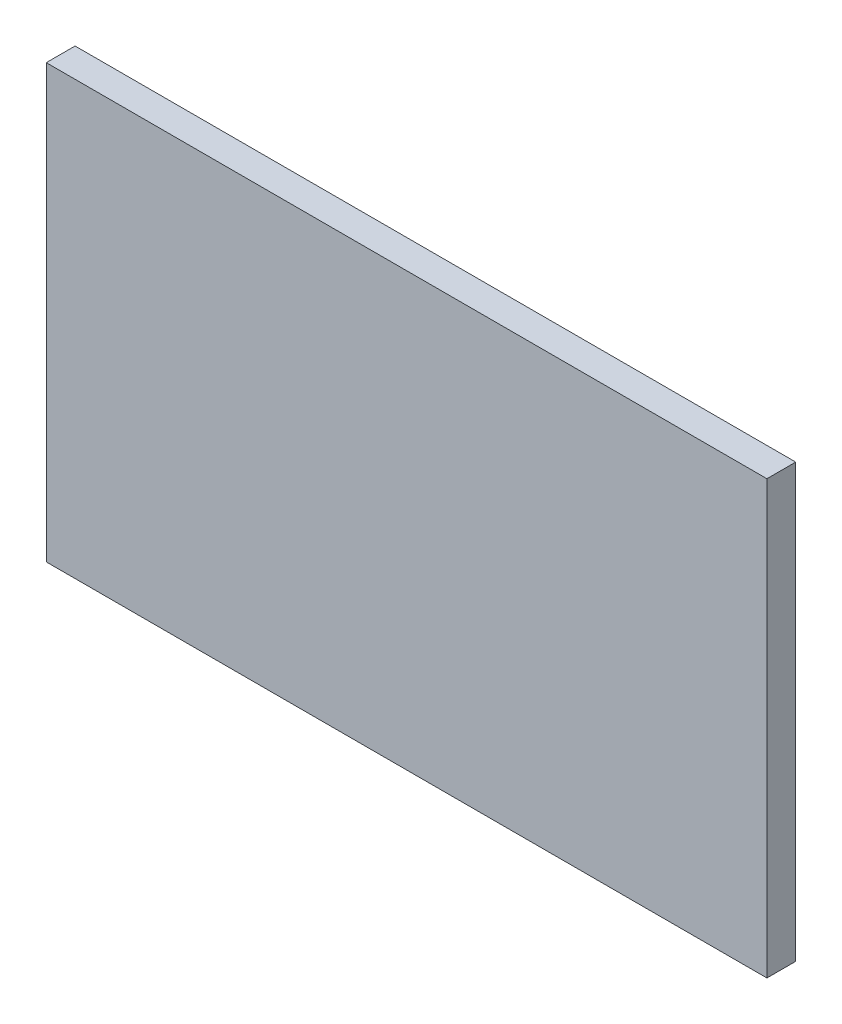
from build123d import *

# Parameters (mm, degrees)
SKETCH1_W           = 100
SKETCH1_H           = 60
BOSS_EXTRUDE1_DEPTH = 4


with BuildPart() as part:
    # Sketch1 → Boss-Extrude1 (new body)
    with BuildSketch(Plane.XY):
        with Locations((-50, -30)):
            Rectangle(SKETCH1_W, SKETCH1_H)
    extrude(amount=BOSS_EXTRUDE1_DEPTH)


solid = part.part
